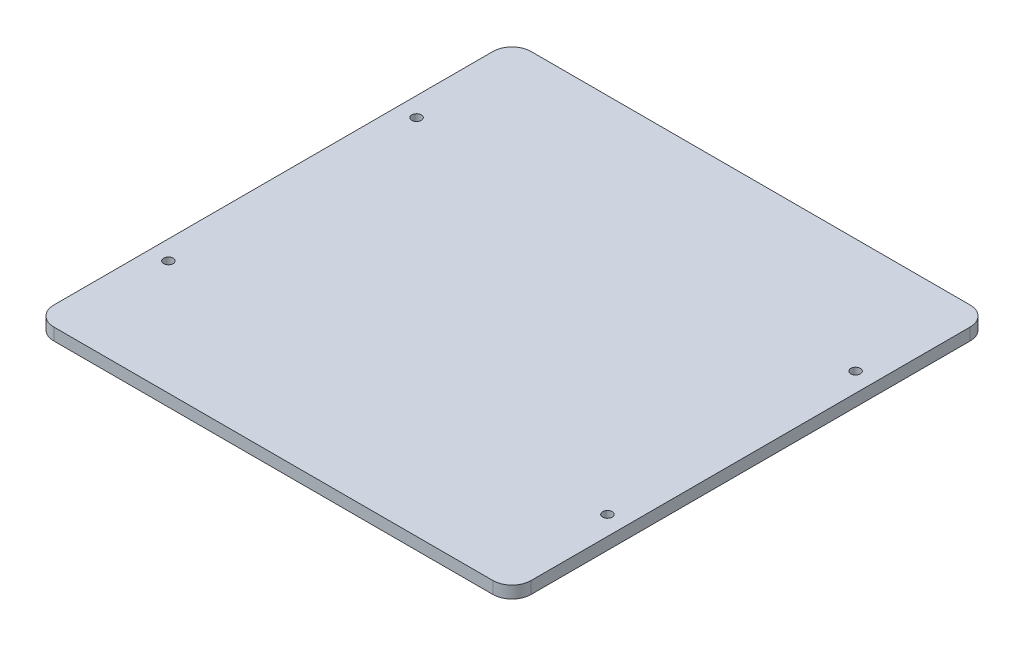
from build123d import *

# Parameters (mm, degrees)
SKETCH1_W           = 250
SKETCH1_H           = 250
BOSS_EXTRUDE1_DEPTH = 6.35
SKETCH2_R           = 2.5
CUT_EXTRUDE1_DEPTH  = 177.890707783
FILLET1_R           = 10


with BuildPart() as part:
    # Sketch1 → Boss-Extrude1 (new body)
    with BuildSketch(Plane(origin=(0, 0, 0), x_dir=(1, 0, 0), z_dir=(0, 1, 0))):
        Rectangle(SKETCH1_W, SKETCH1_H)
    extrude(amount=BOSS_EXTRUDE1_DEPTH)

    # Sketch2 → Cut-Extrude1 (cut, through all)
    with BuildSketch(Plane(origin=(0, 6.35, 0), x_dir=(1, 0, 0), z_dir=(0, 1, 0))):
        with Locations(Location((-115, 65, 0), (0, 0, 270))):
            Circle(SKETCH2_R)
        with Locations(Location((115, 65, 0), (0, 0, 270))):
            Circle(SKETCH2_R)
        with Locations(Location((115, -65, 0), (0, 0, 270))):
            Circle(SKETCH2_R)
        with Locations(Location((-115, -65, 0), (0, 0, 270))):
            Circle(SKETCH2_R)
    extrude(amount=-CUT_EXTRUDE1_DEPTH, mode=Mode.SUBTRACT)

    # Fillet1
    fillet1_edges = [part.edges().sort_by_distance(p)[0] for p in [
        (-125, 3.175, -125),
        (125, 3.175, -125),
        (125, 3.175, 125),
        (-125, 3.175, 125),
    ]]
    fillet(fillet1_edges, radius=FILLET1_R)


solid = part.part
